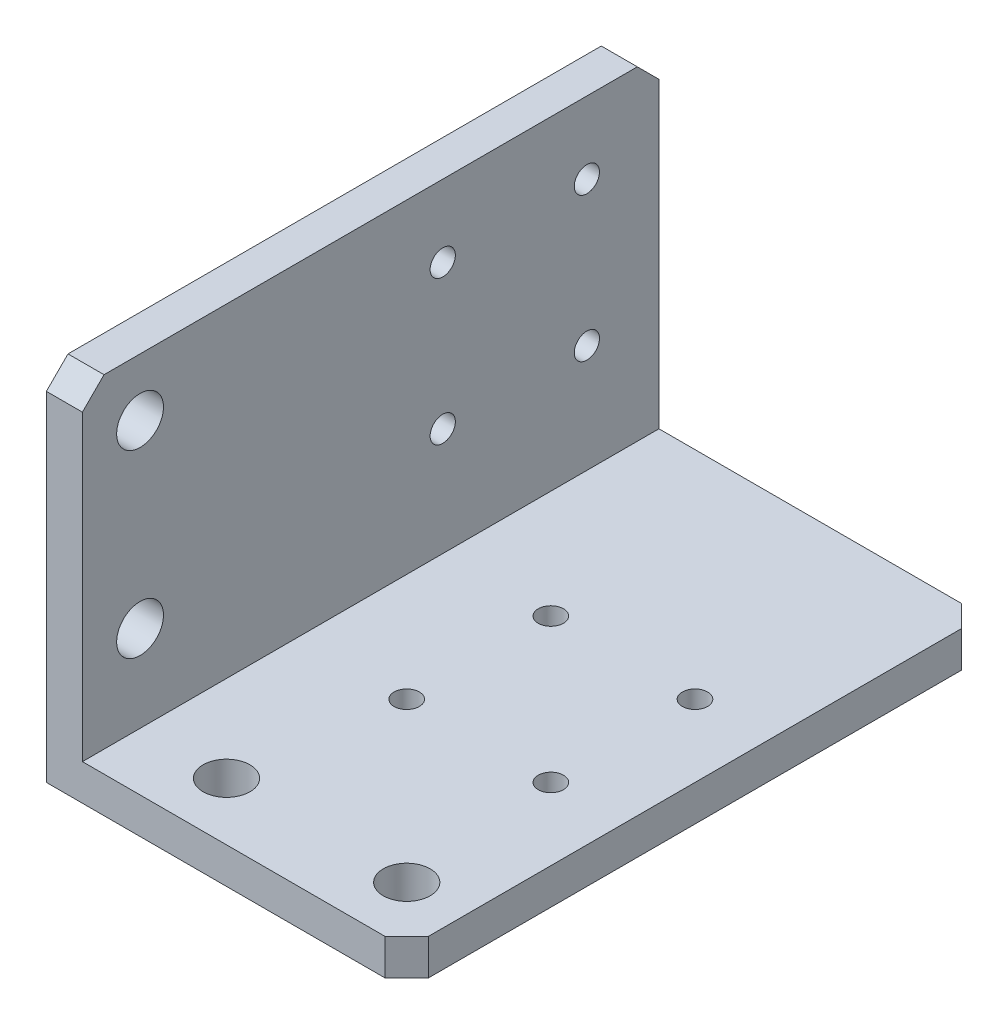
from build123d import *

# Parameters (mm, degrees)
ESTRUSIONE_ESTRUSIONE1_DEPTH = 80
FORO_6_5_6_5_1_D             = 6.5
FORO_6_5_6_5_2_D             = 6.5
FORO_6_5_6_5_2_DEPTH         = 5
FORO_6_5_6_5_2_TIP           = 1.952797012
TAGLIO_ESTRUSIONE3_REACH     = 108.771
SCHIZZO10_R                  = 1.75
TAGLIO_ESTRUSIONE4_REACH     = 108.771
SCHIZZO11_R                  = 1.75
SMUSSO1_SIZE                 = 3


with BuildPart() as part:
    # Schizzo1 → Estrusione-Estrusione1 (new body)
    with BuildSketch(Plane.XY):
        Polygon((0, 0), (0, 50), (5, 50), (5, 5), (50, 5), (50, 0), align=None)
    extrude(amount=ESTRUSIONE_ESTRUSIONE1_DEPTH)

    # Foro Ø6.5 (6.5)-1 (through all)
    with Locations(Plane(origin=(0, 0, 0), x_dir=(-1, 0, 0), z_dir=(0, -1, 0))):
        with Locations((-17, -72), (-42, -72)):
            Hole(FORO_6_5_6_5_1_D / 2)

    # Foro Ø6.5 (6.5)-2
    with Locations(Plane.ZY):
        with Locations((72, 42), (72, 17)):
            Hole(FORO_6_5_6_5_2_D / 2, depth=FORO_6_5_6_5_2_DEPTH)
            with Locations((0, 0, -(FORO_6_5_6_5_2_DEPTH + FORO_6_5_6_5_2_TIP / 2))):  # 118° drill point
                Cone(0, FORO_6_5_6_5_2_D / 2, FORO_6_5_6_5_2_TIP, mode=Mode.SUBTRACT)

    # Schizzo10 → Taglio-Estrusione3 (cut, up to next)
    with BuildSketch(Plane.ZY, mode=Mode.PRIVATE) as taglio_estrusione3_sk1:
        with Locations((10, 40)):
            Circle(SCHIZZO10_R)
    taglio_estrusione3_tool1 = extrude(taglio_estrusione3_sk1.sketch, amount=-TAGLIO_ESTRUSIONE3_REACH, mode=Mode.PRIVATE) & part.part
    # Schizzo10 → Taglio-Estrusione3 (cut, up to next)
    with BuildSketch(Plane.ZY, mode=Mode.PRIVATE) as taglio_estrusione3_sk2:
        with Locations((30, 40)):
            Circle(SCHIZZO10_R)
    taglio_estrusione3_tool2 = extrude(taglio_estrusione3_sk2.sketch, amount=-TAGLIO_ESTRUSIONE3_REACH, mode=Mode.PRIVATE) & part.part
    # Schizzo10 → Taglio-Estrusione3 (cut, up to next)
    with BuildSketch(Plane.ZY, mode=Mode.PRIVATE) as taglio_estrusione3_sk3:
        with Locations((30, 20)):
            Circle(SCHIZZO10_R)
    taglio_estrusione3_tool3 = extrude(taglio_estrusione3_sk3.sketch, amount=-TAGLIO_ESTRUSIONE3_REACH, mode=Mode.PRIVATE) & part.part
    # Schizzo10 → Taglio-Estrusione3 (cut, up to next)
    with BuildSketch(Plane.ZY, mode=Mode.PRIVATE) as taglio_estrusione3_sk4:
        with Locations((10, 20)):
            Circle(SCHIZZO10_R)
    taglio_estrusione3_tool4 = extrude(taglio_estrusione3_sk4.sketch, amount=-TAGLIO_ESTRUSIONE3_REACH, mode=Mode.PRIVATE) & part.part
    add(taglio_estrusione3_tool1.solids().sort_by_distance((0, 40, 10))[0], mode=Mode.SUBTRACT)
    add(taglio_estrusione3_tool2.solids().sort_by_distance((0, 40, 30))[0], mode=Mode.SUBTRACT)
    add(taglio_estrusione3_tool3.solids().sort_by_distance((0, 20, 30))[0], mode=Mode.SUBTRACT)
    add(taglio_estrusione3_tool4.solids().sort_by_distance((0, 20, 10))[0], mode=Mode.SUBTRACT)

    # Schizzo11 → Taglio-Estrusione4 (cut, up to next)
    with BuildSketch(Plane.XZ, mode=Mode.PRIVATE) as taglio_estrusione4_sk1:
        with Locations((20, 30)):
            Circle(SCHIZZO11_R)
    taglio_estrusione4_tool1 = extrude(taglio_estrusione4_sk1.sketch, amount=-TAGLIO_ESTRUSIONE4_REACH, mode=Mode.PRIVATE) & part.part
    # Schizzo11 → Taglio-Estrusione4 (cut, up to next)
    with BuildSketch(Plane.XZ, mode=Mode.PRIVATE) as taglio_estrusione4_sk2:
        with Locations((20, 50)):
            Circle(SCHIZZO11_R)
    taglio_estrusione4_tool2 = extrude(taglio_estrusione4_sk2.sketch, amount=-TAGLIO_ESTRUSIONE4_REACH, mode=Mode.PRIVATE) & part.part
    # Schizzo11 → Taglio-Estrusione4 (cut, up to next)
    with BuildSketch(Plane.XZ, mode=Mode.PRIVATE) as taglio_estrusione4_sk3:
        with Locations((40, 50)):
            Circle(SCHIZZO11_R)
    taglio_estrusione4_tool3 = extrude(taglio_estrusione4_sk3.sketch, amount=-TAGLIO_ESTRUSIONE4_REACH, mode=Mode.PRIVATE) & part.part
    # Schizzo11 → Taglio-Estrusione4 (cut, up to next)
    with BuildSketch(Plane.XZ, mode=Mode.PRIVATE) as taglio_estrusione4_sk4:
        with Locations((40, 30)):
            Circle(SCHIZZO11_R)
    taglio_estrusione4_tool4 = extrude(taglio_estrusione4_sk4.sketch, amount=-TAGLIO_ESTRUSIONE4_REACH, mode=Mode.PRIVATE) & part.part
    add(taglio_estrusione4_tool1.solids().sort_by_distance((20, 0, 30))[0], mode=Mode.SUBTRACT)
    add(taglio_estrusione4_tool2.solids().sort_by_distance((20, 0, 50))[0], mode=Mode.SUBTRACT)
    add(taglio_estrusione4_tool3.solids().sort_by_distance((40, 0, 50))[0], mode=Mode.SUBTRACT)
    add(taglio_estrusione4_tool4.solids().sort_by_distance((40, 0, 30))[0], mode=Mode.SUBTRACT)

    # Smusso1
    smusso1_edges = [part.edges().sort_by_distance(p)[0] for p in [
        (2.5, 50, 80),
        (2.5, 50, 0),
        (50, 2.5, 80),
        (50, 2.5, 0),
    ]]
    chamfer(smusso1_edges, length=SMUSSO1_SIZE)


solid = part.part
